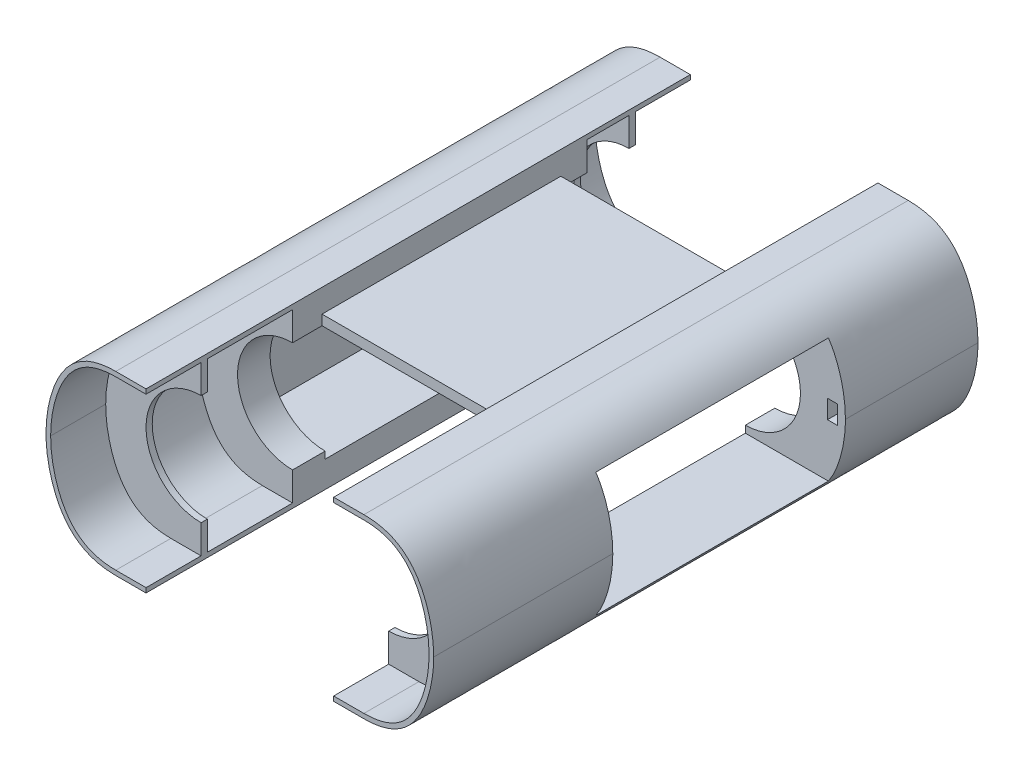
from build123d import *

# Parameters (mm, degrees)
EXTRUDE_1_DEPTH      = 140
EXTRUDE_1_DEPTH_BACK = 140
EXTRUDE_3_DEPTH      = 35.5
CUT_EXTRUDE_2_REACH  = 197.473
SKETCH_6_W           = 150
SKETCH_6_H           = 80
CUT_EXTRUDE_4_DEPTH  = 6
EXTRUDE_4_DEPTH      = 60.5
CUT_EXTRUDE_START    = -59
CUT_EXTRUDE_6_DEPTH  = 55
CUT_EXTRUDE_START_2  = -4
CUT_EXTRUDE_7_DEPTH  = 27
CUT_EXTRUDE_8_DEPTH  = 35.5
CUT_EXTRUDE_START_3  = -35.5
CUT_EXTRUDE_9_DEPTH  = 35.5
EXTRUDE_5_REACH      = 300.939


with BuildPart() as part:
    # 草图2 → 凸台-拉伸1 (new, two sides: drawn at the far end of the back side and taken through both)
    with BuildSketch(Plane.XY.offset(-EXTRUDE_1_DEPTH_BACK)):
        with BuildLine():
            Line((60.5, 57), (80, 57))
            add(Edge.make_bspline(
                [(80, 57), (110.715171184, 57), (118.023084898, 36.99301361), (125, 20.498008369), (125, 0)],
                knots=[0, 0, 0, 0, 0, 1, 1, 1, 1, 1], degree=4))
            add(Edge.make_bspline(
                [(80, -57), (110.715171184, -57), (118.023084898, -36.99301361), (125, -20.498008369), (125, 0)],
                knots=[0, 0, 0, 0, 0, 1, 1, 1, 1, 1], degree=4))
            Line((80, -57), (60.5, -57))
            Line((60.5, -57), (60.5, -35.5))
            ThreePointArc((60.5, -35.5), (96, 0), (60.5, 35.5))
            Line((60.5, 35.5), (60.5, 57))
        make_face()
    extrude(amount=EXTRUDE_1_DEPTH + EXTRUDE_1_DEPTH_BACK)

    # 草图5 → 凸台-拉伸3 (add)
    with BuildSketch(Plane.XY.offset(140)):
        with BuildLine():
            Line((60.5, -50), (60.5, -57))
            Line((60.5, -57), (80, -57))
            add(Edge.make_bspline(
                [(80, -57), (110.715171184, -57), (118.023084898, -36.99301361), (125, -20.498008369), (125, 0)],
                knots=[0, 0, 0, 0, 0, 1, 1, 1, 1, 1], degree=4))
            add(Edge.make_bspline(
                [(125, 0), (125, 20.498008369), (118.023084898, 36.99301361), (110.715171184, 57), (80, 57)],
                knots=[0, 0, 0, 0, 0, 1, 1, 1, 1, 1], degree=4))
            Line((80, 57), (60.5, 57))
            Line((60.5, 57), (60.5, 50))
            ThreePointArc((60.5, 50), (110.5, 0), (60.5, -50))
        make_face()
    extrude_3 = extrude(amount=EXTRUDE_3_DEPTH)

    # 镜向2: 凸台-拉伸3 across plane
    add(extrude_3.mirror(Plane.XY))

    # 草图6 → 切除-拉伸2 (cut, up to next)
    with BuildSketch(Plane.ZY.offset(-60.5), mode=Mode.PRIVATE) as cut_extrude_2_sk1:
        with Locations((-15, 0)):
            Rectangle(SKETCH_6_W, SKETCH_6_H)
    cut_extrude_2_tool1 = extrude(cut_extrude_2_sk1.sketch, amount=-CUT_EXTRUDE_2_REACH, mode=Mode.PRIVATE) & part.part
    add(cut_extrude_2_tool1.solids().sort_by_distance((60.5, 0, -15))[0], mode=Mode.SUBTRACT)

    # 草图9 → 切除-拉伸4 (cut, symmetric)
    with BuildSketch(Plane(origin=(0, 0, 0), x_dir=(1, 0, 0), z_dir=(0, 1, 0))):
        Polygon((113.429186382, -60), (119.929186382, -60), (119.929186382, -75), (116.929186382, -75), (111.929186382, -69.041232037), (113.429186382, -67.541232037), align=None)
    cut_extrude_4 = extrude(amount=CUT_EXTRUDE_4_DEPTH, both=True, mode=Mode.SUBTRACT)

    # 镜向3: 切除-拉伸4 across plane
    add(cut_extrude_4.mirror(Plane(origin=(0, 0, -15), x_dir=(1, 0, 0), z_dir=(0, 0, -1))), mode=Mode.SUBTRACT)

    # 草图10 → 凸台-拉伸4 (add)
    with BuildSketch(Plane.ZY.offset(-60.5)):
        Polygon((-90, 40), (-90, 35.5), (-92, 35.5), (-92, 42), (62, 42), (62, 35.5), (60, 35.5), (60, 40), align=None)
    extrude(amount=EXTRUDE_4_DEPTH)

    # 草图18 → 切除-拉伸6 (cut)
    with BuildSketch(Plane.XY.offset(140).offset(CUT_EXTRUDE_START)):
        with BuildLine():
            Line((60.5, 54), (60.5, 35.5))
            ThreePointArc((60.5, 35.5), (96, 0), (60.5, -35.5))
            Line((60.5, -35.5), (60.5, -54))
            Line((60.5, -54), (80, -54))
            add(Edge.make_bspline(
                [(80, -54), (84.874930894, -54), (88.983824843, -53.408674679), (94.293485921, -51.914645093), (95.921328006, -51.314644751), (98.940749379, -49.944603182), (100.332473442, -49.174486853), (102.921509382, -47.489185635), (104.118858715, -46.573864409), (106.351651802, -44.617586852), (107.387031345, -43.57654345), (110.285874468, -40.291394559), (111.943828956, -37.885646851), (114.834227827, -32.778060673), (116.065931681, -30.077252128), (118.174928997, -24.486846885), (119.052306998, -21.597764181), (120.481395372, -15.683640995), (121.033233096, -12.658872533), (121.792444122, -6.461288023), (122, -3.288695832), (122, 0)],
                knots=[0, 0, 0, 0, 0.125, 0.125, 0.1875, 0.1875, 0.25, 0.25, 0.3125, 0.3125, 0.375, 0.375, 0.5, 0.5, 0.625, 0.625, 0.75, 0.75, 0.875, 0.875, 1, 1, 1, 1], degree=3))
            add(Edge.make_bspline(
                [(122, 0), (122, 3.288695832), (121.792444122, 6.461288023), (121.033233096, 12.658872533), (120.481395372, 15.683640995), (119.052306998, 21.597764181), (118.174928997, 24.486846885), (116.065931681, 30.077252128), (114.834227827, 32.778060673), (111.943828956, 37.885646851), (110.285874468, 40.291394559), (107.387031345, 43.57654345), (106.351651802, 44.617586852), (104.118858715, 46.573864409), (102.921509382, 47.489185635), (100.332473442, 49.174486853), (98.940749379, 49.944603182), (95.921328006, 51.314644751), (94.293485921, 51.914645093), (88.983824843, 53.408674679), (84.874930894, 54), (80, 54)],
                knots=[0, 0, 0, 0, 0.125, 0.125, 0.25, 0.25, 0.375, 0.375, 0.5, 0.5, 0.625, 0.625, 0.6875, 0.6875, 0.75, 0.75, 0.8125, 0.8125, 0.875, 0.875, 1, 1, 1, 1], degree=3))
            Line((80, 54), (60.5, 54))
        make_face()
    extrude(amount=CUT_EXTRUDE_6_DEPTH, mode=Mode.SUBTRACT)

    # 草图19 → 切除-拉伸7 (cut)
    with BuildSketch(Plane(origin=(0, 0, -140), x_dir=(-1, 0, 0), z_dir=(0, 0, -1)).offset(CUT_EXTRUDE_START_2)):
        with BuildLine():
            Line((-60.5, 54), (-60.5, 35.5))
            ThreePointArc((-60.5, 35.5), (-96, 0), (-60.5, -35.5))
            Line((-60.5, -35.5), (-60.5, -54))
            Line((-60.5, -54), (-80, -54))
            add(Edge.make_bspline(
                [(-80, -54), (-84.874930894, -54), (-88.983824843, -53.408674679), (-94.293485921, -51.914645093), (-95.921328006, -51.314644751), (-98.940749379, -49.944603182), (-100.332473442, -49.174486853), (-102.921509382, -47.489185635), (-104.118858715, -46.573864409), (-106.351651802, -44.617586852), (-107.387031345, -43.57654345), (-110.285874468, -40.291394559), (-111.943828956, -37.885646851), (-114.834227827, -32.778060673), (-116.065931681, -30.077252128), (-118.174928997, -24.486846885), (-119.052306998, -21.597764181), (-120.481395372, -15.683640995), (-121.033233096, -12.658872533), (-121.792444122, -6.461288023), (-122, -3.288695832), (-122, 0)],
                knots=[0, 0, 0, 0, 0.125, 0.125, 0.1875, 0.1875, 0.25, 0.25, 0.3125, 0.3125, 0.375, 0.375, 0.5, 0.5, 0.625, 0.625, 0.75, 0.75, 0.875, 0.875, 1, 1, 1, 1], degree=3))
            add(Edge.make_bspline(
                [(-122, 0), (-122, 3.288695832), (-121.792444122, 6.461288023), (-121.033233096, 12.658872533), (-120.481395372, 15.683640995), (-119.052306998, 21.597764181), (-118.174928997, 24.486846885), (-116.065931681, 30.077252128), (-114.834227827, 32.778060673), (-111.943828956, 37.885646851), (-110.285874468, 40.291394559), (-107.387031345, 43.57654345), (-106.351651802, 44.617586852), (-104.118858715, 46.573864409), (-102.921509382, 47.489185635), (-100.332473442, 49.174486853), (-98.940749379, 49.944603182), (-95.921328006, 51.314644751), (-94.293485921, 51.914645093), (-88.983824843, 53.408674679), (-84.874930894, 54), (-80, 54)],
                knots=[0, 0, 0, 0, 0.125, 0.125, 0.25, 0.25, 0.375, 0.375, 0.5, 0.5, 0.625, 0.625, 0.6875, 0.6875, 0.75, 0.75, 0.8125, 0.8125, 0.875, 0.875, 1, 1, 1, 1], degree=3))
            Line((-80, 54), (-60.5, 54))
        make_face()
    extrude(amount=-CUT_EXTRUDE_7_DEPTH, mode=Mode.SUBTRACT)

    # 草图20 → 切除-拉伸8 (cut)
    with BuildSketch(Plane.XY.offset(175.5)):
        with BuildLine():
            Line((60.5, 54), (60.5, 50))
            ThreePointArc((60.5, 50), (110.5, 0), (60.5, -50))
            Line((60.5, -50), (60.5, -54))
            Line((60.5, -54), (80, -54))
            add(Edge.make_bspline(
                [(80, -54), (84.874930894, -54), (88.983824843, -53.408674679), (94.293485921, -51.914645093), (95.921328006, -51.314644751), (98.940749379, -49.944603182), (100.332473442, -49.174486853), (102.921509382, -47.489185635), (104.118858715, -46.573864409), (106.351651802, -44.617586852), (107.387031345, -43.57654345), (110.285874468, -40.291394559), (111.943828956, -37.885646851), (114.834227827, -32.778060673), (116.065931681, -30.077252128), (118.174928997, -24.486846885), (119.052306998, -21.597764181), (120.481395372, -15.683640995), (121.033233096, -12.658872533), (121.792444122, -6.461288023), (122, -3.288695832), (122, 0)],
                knots=[0, 0, 0, 0, 0.125, 0.125, 0.1875, 0.1875, 0.25, 0.25, 0.3125, 0.3125, 0.375, 0.375, 0.5, 0.5, 0.625, 0.625, 0.75, 0.75, 0.875, 0.875, 1, 1, 1, 1], degree=3))
            add(Edge.make_bspline(
                [(122, 0), (122, 3.288695832), (121.792444122, 6.461288023), (121.033233096, 12.658872533), (120.481395372, 15.683640995), (119.052306998, 21.597764181), (118.174928997, 24.486846885), (116.065931681, 30.077252128), (114.834227827, 32.778060673), (111.943828956, 37.885646851), (110.285874468, 40.291394559), (107.387031345, 43.57654345), (106.351651802, 44.617586852), (104.118858715, 46.573864409), (102.921509382, 47.489185635), (100.332473442, 49.174486853), (98.940749379, 49.944603182), (95.921328006, 51.314644751), (94.293485921, 51.914645093), (88.983824843, 53.408674679), (84.874930894, 54), (80, 54)],
                knots=[0, 0, 0, 0, 0.125, 0.125, 0.25, 0.25, 0.375, 0.375, 0.5, 0.5, 0.625, 0.625, 0.6875, 0.6875, 0.75, 0.75, 0.8125, 0.8125, 0.875, 0.875, 1, 1, 1, 1], degree=3))
            Line((80, 54), (60.5, 54))
        make_face()
    extrude(amount=-CUT_EXTRUDE_8_DEPTH, mode=Mode.SUBTRACT)

    # 草图21 → 切除-拉伸9 (cut)
    with BuildSketch(Plane(origin=(0, 0, -175.5), x_dir=(-1, 0, 0), z_dir=(0, 0, -1)).offset(CUT_EXTRUDE_START_3)):
        with BuildLine():
            Line((-60.5, -50), (-60.5, -54))
            Line((-60.5, -54), (-80, -54))
            add(Edge.make_bspline(
                [(-80, -54), (-84.874930894, -54), (-88.983824843, -53.408674679), (-94.293485921, -51.914645093), (-95.921328006, -51.314644751), (-98.940749379, -49.944603182), (-100.332473442, -49.174486853), (-102.921509382, -47.489185635), (-104.118858715, -46.573864409), (-106.351651802, -44.617586852), (-107.387031345, -43.57654345), (-110.285874468, -40.291394559), (-111.943828956, -37.885646851), (-114.834227827, -32.778060673), (-116.065931681, -30.077252128), (-118.174928997, -24.486846885), (-119.052306998, -21.597764181), (-120.481395372, -15.683640995), (-121.033233096, -12.658872533), (-121.792444122, -6.461288023), (-122, -3.288695832), (-122, 0)],
                knots=[0, 0, 0, 0, 0.125, 0.125, 0.1875, 0.1875, 0.25, 0.25, 0.3125, 0.3125, 0.375, 0.375, 0.5, 0.5, 0.625, 0.625, 0.75, 0.75, 0.875, 0.875, 1, 1, 1, 1], degree=3))
            add(Edge.make_bspline(
                [(-122, 0), (-122, 3.288695832), (-121.792444122, 6.461288023), (-121.033233096, 12.658872533), (-120.481395372, 15.683640995), (-119.052306998, 21.597764181), (-118.174928997, 24.486846885), (-116.065931681, 30.077252128), (-114.834227827, 32.778060673), (-111.943828956, 37.885646851), (-110.285874468, 40.291394559), (-107.387031345, 43.57654345), (-106.351651802, 44.617586852), (-104.118858715, 46.573864409), (-102.921509382, 47.489185635), (-100.332473442, 49.174486853), (-98.940749379, 49.944603182), (-95.921328006, 51.314644751), (-94.293485921, 51.914645093), (-88.983824843, 53.408674679), (-84.874930894, 54), (-80, 54)],
                knots=[0, 0, 0, 0, 0.125, 0.125, 0.25, 0.25, 0.375, 0.375, 0.5, 0.5, 0.625, 0.625, 0.6875, 0.6875, 0.75, 0.75, 0.8125, 0.8125, 0.875, 0.875, 1, 1, 1, 1], degree=3))
            Line((-80, 54), (-60.5, 54))
            Line((-60.5, 54), (-60.5, 50))
            ThreePointArc((-60.5, 50), (-110.5, 0), (-60.5, -50))
        make_face()
    extrude(amount=CUT_EXTRUDE_9_DEPTH, mode=Mode.SUBTRACT)

    # 镜向9: part across plane


with BuildPart() as part_1:
    add(part.part)
    add(part.part.mirror(Plane.ZY))

    # 草图23 → 凸台-拉伸5 (add, up to next)
    with BuildSketch(Plane.XY.offset(-90), mode=Mode.PRIVATE) as extrude_5_sk1:
        with BuildLine():
            Line((-114.034351089, 40), (-110, 40))
            Line((-110, 40), (-110, -40))
            Line((-110, -40), (-114.034351089, -40))
            add(Edge.make_bspline(
                [(-114.034351089, -40), (-119.771865737, -31.446745908), (-122.888445187, -21.34184926), (-125, -11.276676628), (-125, 0)],
                knots=[0.449864766, 0.449864766, 0.449864766, 0.449864766, 0.449864766, 1, 1, 1, 1, 1], degree=4))
            add(Edge.make_bspline(
                [(-125, 0), (-125, 11.276676628), (-122.888445187, 21.34184926), (-119.771865737, 31.446745908), (-114.034351089, 40)],
                knots=[0, 0, 0, 0, 0, 0.550135234, 0.550135234, 0.550135234, 0.550135234, 0.550135234], degree=4))
        make_face()
    extrude_5_tool1 = extrude(extrude_5_sk1.sketch, amount=EXTRUDE_5_REACH, mode=Mode.PRIVATE) - part_1.part
    add(extrude_5_tool1.solids().sort_by_distance((-116.2158, 0, -90))[0])


solid = part_1.part
